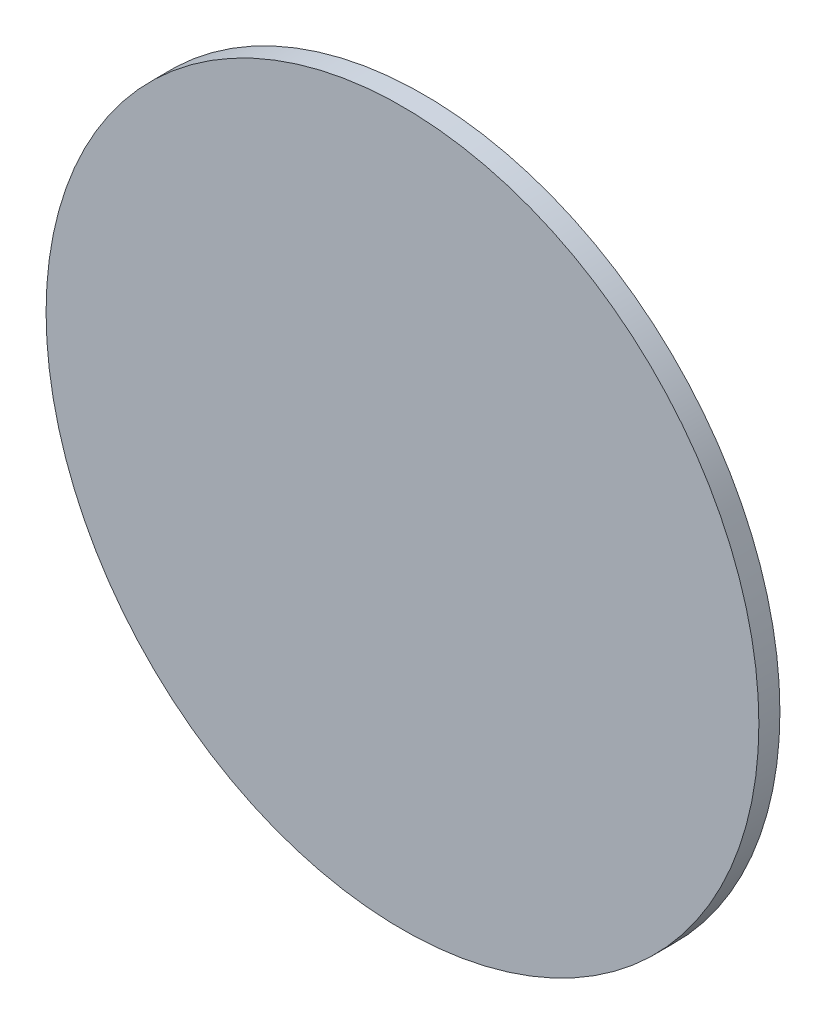
from build123d import *

# Parameters (mm, degrees)
SKETCH1_R           = 50.8
BOSS_EXTRUDE1_DEPTH = 3


with BuildPart() as part:
    # Sketch1 → Boss-Extrude1 (new body)
    with BuildSketch(Plane.XY):
        Circle(SKETCH1_R)
    extrude(amount=BOSS_EXTRUDE1_DEPTH)


solid = part.part
